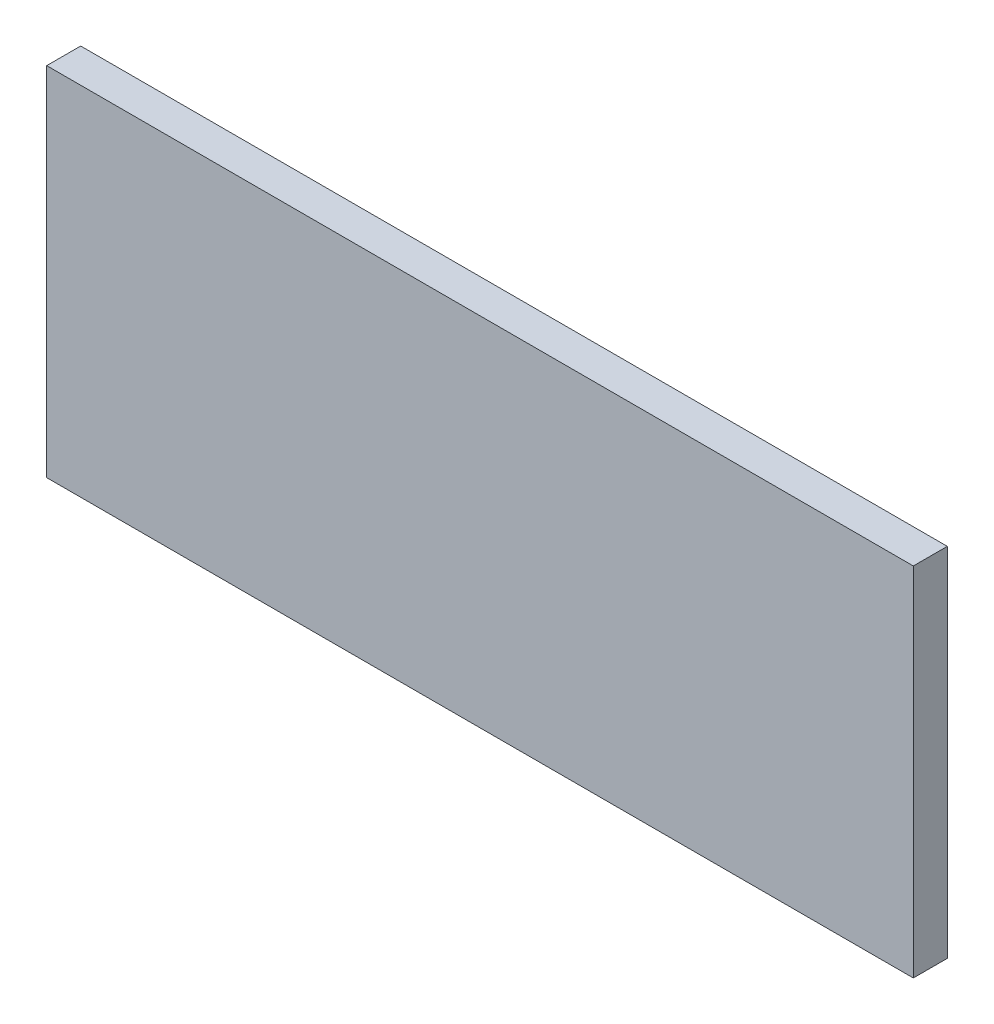
from build123d import *

# Parameters (mm, degrees)
SKETCH2_W           = 102
SKETCH2_H           = 42
BOSS_EXTRUDE1_DEPTH = 4


with BuildPart() as part:
    # Sketch2 → Boss-Extrude1 (new body)
    with BuildSketch(Plane.XY):
        Rectangle(SKETCH2_W, SKETCH2_H)
    extrude(amount=BOSS_EXTRUDE1_DEPTH)


solid = part.part
